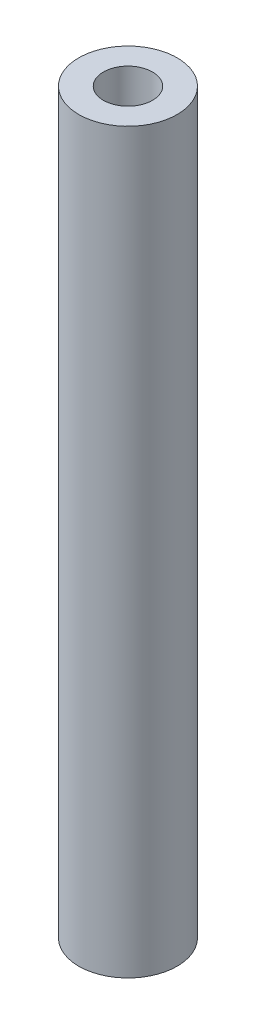
from build123d import *

# Parameters (mm, degrees)
SKETCH_1_R      = 2
SKETCH_1_R_2    = 1
EXTRUDE_1_DEPTH = 30


with BuildPart() as part:
    # 草图1 → 凸台-拉伸1 (new body)
    with BuildSketch(Plane(origin=(0, 0, 0), x_dir=(1, 0, 0), z_dir=(0, 1, 0))):
        with Locations(Location((0, 0, 0), (0, 0, 270))):
            Circle(SKETCH_1_R)
        with Locations(Location((0, 0, 0), (0, 0, 270))):
            Circle(SKETCH_1_R_2, mode=Mode.SUBTRACT)
    extrude(amount=EXTRUDE_1_DEPTH)


solid = part.part
